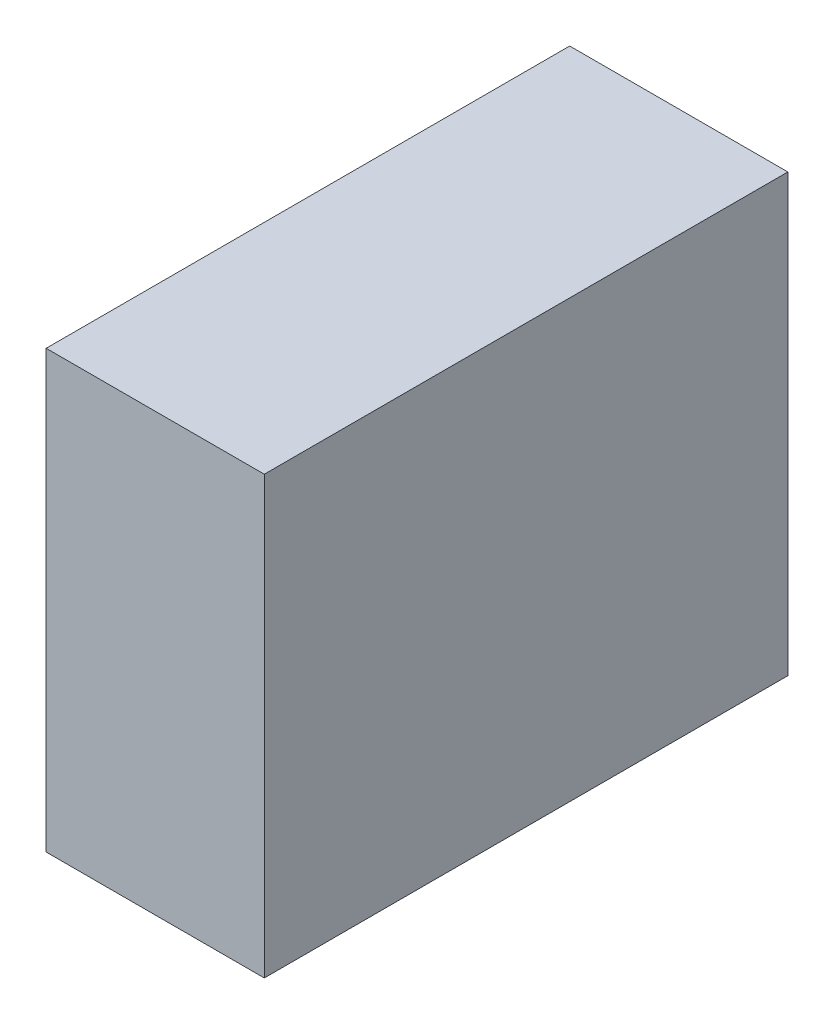
from build123d import *

# Parameters (mm, degrees)
OVEN_PANO_SURUCU_MENTESE_1_1_START = -128
SKETCH1_W                          = 50
SKETCH1_H                          = 100
OVEN_PANO_SURUCU_MENTESE_1_1_DEPTH = 120


with BuildPart() as part:
    # Sketch1 → OVEN_pano_surucu_mentese_1_1 (new body)
    with BuildSketch(Plane.XY.offset(OVEN_PANO_SURUCU_MENTESE_1_1_START)):
        with Locations((325, 250)):
            Rectangle(SKETCH1_W, SKETCH1_H)
    extrude(amount=-OVEN_PANO_SURUCU_MENTESE_1_1_DEPTH)


solid = part.part
